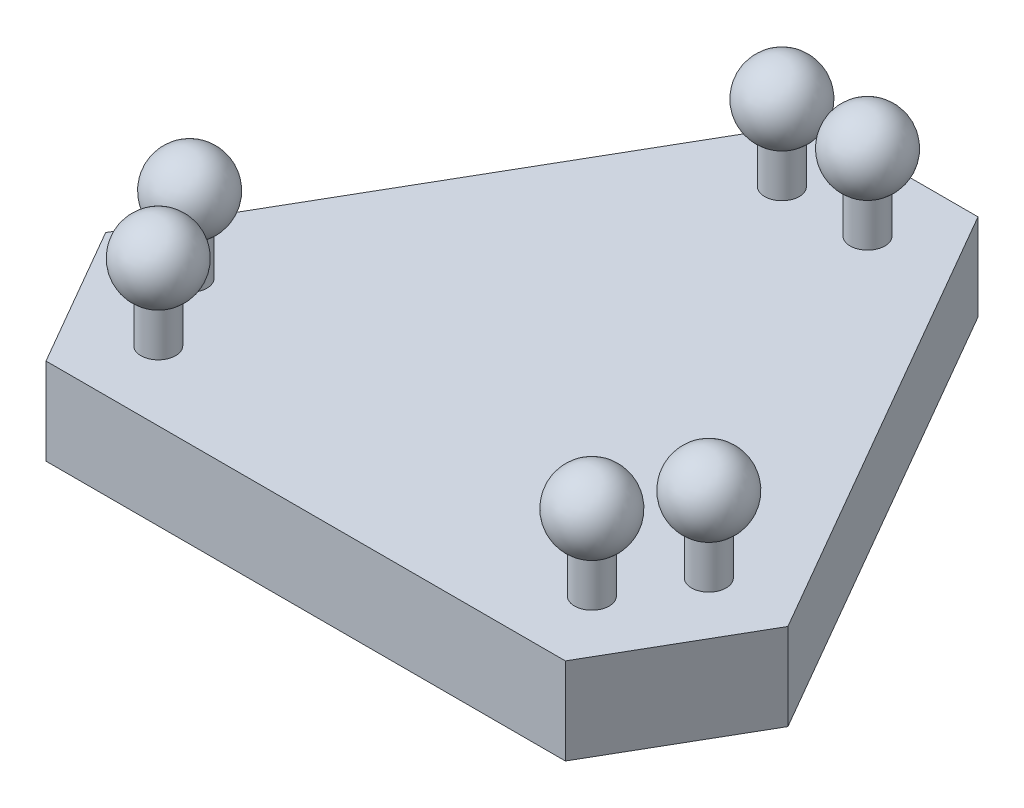
from build123d import *

# Parameters (mm, degrees)
BOSS_EXTRUDE1_DEPTH = 10
SKETCH3_R           = 2
BOSS_EXTRUDE2_DEPTH = 5
DOME1_FACE_RADIUS   = 2
DOME1_HEIGHT        = 8
DOME2_FACE_RADIUS   = 2
DOME2_HEIGHT        = 8
DOME3_FACE_RADIUS   = 2
DOME3_HEIGHT        = 8
DOME4_FACE_RADIUS   = 2
DOME4_HEIGHT        = 8
DOME5_FACE_RADIUS   = 2
DOME5_HEIGHT        = 8
DOME6_FACE_RADIUS   = 2
DOME6_HEIGHT        = 8


with BuildPart() as part:
    # Sketch1 → Boss-Extrude1 (new body)
    with BuildSketch(Plane(origin=(0, 0, 0), x_dir=(1, 0, 0), z_dir=(0, 1, 0))):
        Polygon((-9.391819351, 40), (-39.336925827, -11.866445855), (-29.945106476, -28.133554145), (29.945106476, -28.133554145), (39.336925827, -11.866445855), (9.391819351, 40), align=None)
    extrude(amount=BOSS_EXTRUDE1_DEPTH)

    # Sketch2 → Revolve1 (revolve)
    with BuildSketch(Plane.XY):
        Polygon((-0.301325351, -20), (-15, 0), (0, 0), (0, -20), align=None)
    revolve(axis=Axis((0, 0, 0), (0, -1, 0)))

    # Sketch3 → Boss-Extrude2 (add)
    with BuildSketch(Plane(origin=(0, 10, 0), x_dir=(1, 0, 0), z_dir=(0, 1, 0))):
        with Locations(Location((-4.936169358, 31.717412167, 0), (0, 0, 270))):
            Circle(SKETCH3_R)
        with Locations(Location((-29.936169358, -11.583858022, 0), (0, 0, 270))):
            Circle(SKETCH3_R)
        with Locations(Location((4.936169358, 31.717412167, 0), (0, 0, 270))):
            Circle(SKETCH3_R)
        with Locations(Location((29.936169358, -11.583858022, 0), (0, 0, 270))):
            Circle(SKETCH3_R)
        with Locations(Location((25, -20.133554145, 0), (0, 0, 270))):
            Circle(SKETCH3_R)
        with Locations(Location((-25, -20.133554145, 0), (0, 0, 270))):
            Circle(SKETCH3_R)
    extrude(amount=BOSS_EXTRUDE2_DEPTH)

    # Dome1: a dome of height H over a round flat face of radius A is a cap of a sphere of radius (A * A + H * H) / (2 * H)
    dome1_r = (DOME1_FACE_RADIUS * DOME1_FACE_RADIUS + DOME1_HEIGHT * DOME1_HEIGHT) / (2 * DOME1_HEIGHT)
    dome1_base = Plane((-29.936169358, 15, 11.583858022), z_dir=(0, 1, 0))
    with Locations(dome1_base.offset(DOME1_HEIGHT - dome1_r)):
        dome1_ball = Sphere(dome1_r, mode=Mode.PRIVATE)
    add(split(dome1_ball, bisect_by=dome1_base, keep=Keep.TOP, mode=Mode.PRIVATE))

    # Dome2: a dome of height H over a round flat face of radius A is a cap of a sphere of radius (A * A + H * H) / (2 * H)
    dome2_r = (DOME2_FACE_RADIUS * DOME2_FACE_RADIUS + DOME2_HEIGHT * DOME2_HEIGHT) / (2 * DOME2_HEIGHT)
    dome2_base = Plane((-4.936169358, 15, -31.717412167), z_dir=(0, 1, 0))
    with Locations(dome2_base.offset(DOME2_HEIGHT - dome2_r)):
        dome2_ball = Sphere(dome2_r, mode=Mode.PRIVATE)
    add(split(dome2_ball, bisect_by=dome2_base, keep=Keep.TOP, mode=Mode.PRIVATE))

    # Dome3: a dome of height H over a round flat face of radius A is a cap of a sphere of radius (A * A + H * H) / (2 * H)
    dome3_r = (DOME3_FACE_RADIUS * DOME3_FACE_RADIUS + DOME3_HEIGHT * DOME3_HEIGHT) / (2 * DOME3_HEIGHT)
    dome3_base = Plane((4.936169358, 15, -31.717412167), z_dir=(0, 1, 0))
    with Locations(dome3_base.offset(DOME3_HEIGHT - dome3_r)):
        dome3_ball = Sphere(dome3_r, mode=Mode.PRIVATE)
    add(split(dome3_ball, bisect_by=dome3_base, keep=Keep.TOP, mode=Mode.PRIVATE))

    # Dome4: a dome of height H over a round flat face of radius A is a cap of a sphere of radius (A * A + H * H) / (2 * H)
    dome4_r = (DOME4_FACE_RADIUS * DOME4_FACE_RADIUS + DOME4_HEIGHT * DOME4_HEIGHT) / (2 * DOME4_HEIGHT)
    dome4_base = Plane((29.936169358, 15, 11.583858022), z_dir=(0, 1, 0))
    with Locations(dome4_base.offset(DOME4_HEIGHT - dome4_r)):
        dome4_ball = Sphere(dome4_r, mode=Mode.PRIVATE)
    add(split(dome4_ball, bisect_by=dome4_base, keep=Keep.TOP, mode=Mode.PRIVATE))

    # Dome5: a dome of height H over a round flat face of radius A is a cap of a sphere of radius (A * A + H * H) / (2 * H)
    dome5_r = (DOME5_FACE_RADIUS * DOME5_FACE_RADIUS + DOME5_HEIGHT * DOME5_HEIGHT) / (2 * DOME5_HEIGHT)
    dome5_base = Plane((25, 15, 20.133554145), z_dir=(0, 1, 0))
    with Locations(dome5_base.offset(DOME5_HEIGHT - dome5_r)):
        dome5_ball = Sphere(dome5_r, mode=Mode.PRIVATE)
    add(split(dome5_ball, bisect_by=dome5_base, keep=Keep.TOP, mode=Mode.PRIVATE))

    # Dome6: a dome of height H over a round flat face of radius A is a cap of a sphere of radius (A * A + H * H) / (2 * H)
    dome6_r = (DOME6_FACE_RADIUS * DOME6_FACE_RADIUS + DOME6_HEIGHT * DOME6_HEIGHT) / (2 * DOME6_HEIGHT)
    dome6_base = Plane((-25, 15, 20.133554145), z_dir=(0, 1, 0))
    with Locations(dome6_base.offset(DOME6_HEIGHT - dome6_r)):
        dome6_ball = Sphere(dome6_r, mode=Mode.PRIVATE)
    add(split(dome6_ball, bisect_by=dome6_base, keep=Keep.TOP, mode=Mode.PRIVATE))


solid = part.part
